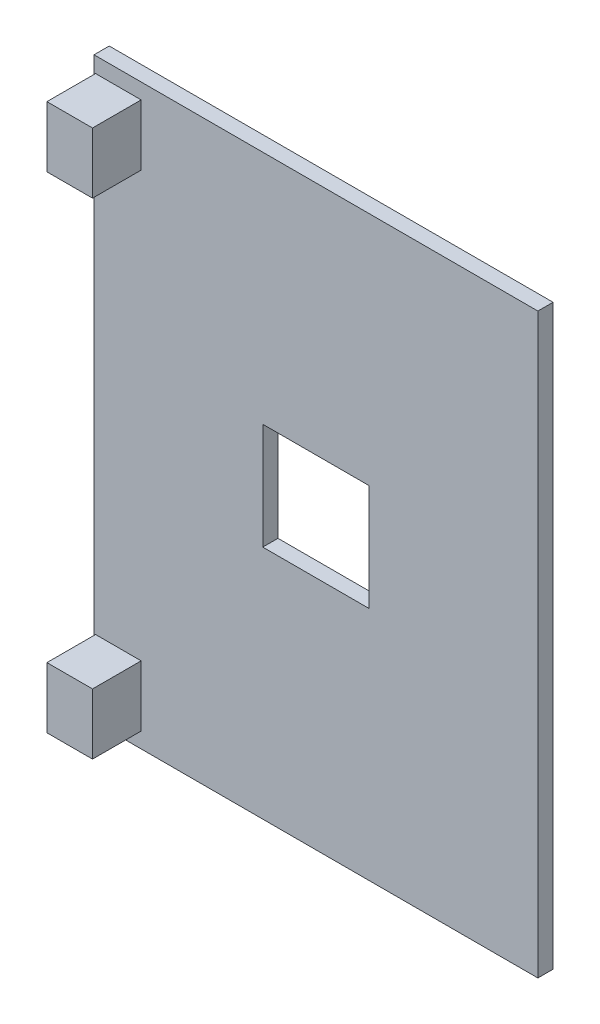
from build123d import *

# Parameters (mm, degrees)
ESQUISSE1_W             = 146
ESQUISSE1_H             = 190
BOSS_EXTRU_1_DEPTH      = 5
ESQUISSE15_W            = 15
ESQUISSE15_H            = 20
BOSS_EXTRU_7_DEPTH      = 16
ESQUISSE16_W            = 15
ESQUISSE16_H            = 20
BOSS_EXTRU_8_DEPTH      = 16
ESQUISSE17_W            = 35
ESQUISSE17_H            = 35
ENL_V_MAT_EXTRU_1_DEPTH = 5


with BuildPart() as part:
    # Esquisse1 → Boss.-Extru.1 (new body)
    with BuildSketch(Plane.XY):
        with Locations((-35.228613981, 18.194490743)):
            Rectangle(ESQUISSE1_W, ESQUISSE1_H)
    extrude(amount=BOSS_EXTRU_1_DEPTH)

    # Esquisse15 → Boss.-Extru.7 (add)
    with BuildSketch(Plane.XY.offset(5)):
        with Locations((-100.228613981, -61.705509257)):
            Rectangle(ESQUISSE15_W, ESQUISSE15_H)
    extrude(amount=BOSS_EXTRU_7_DEPTH)

    # Esquisse16 → Boss.-Extru.8 (add)
    with BuildSketch(Plane.XY.offset(5)):
        with Locations((-100.228613981, 98.094490743)):
            Rectangle(ESQUISSE16_W, ESQUISSE16_H)
    extrude(amount=BOSS_EXTRU_8_DEPTH)

    # Esquisse17 → Enlèv. mat.-Extru.1 (cut)
    with BuildSketch(Plane.XY.offset(5)):
        with Locations((-35.228613981, 18.194490743)):
            Rectangle(ESQUISSE17_W, ESQUISSE17_H)
    extrude(amount=-ENL_V_MAT_EXTRU_1_DEPTH, mode=Mode.SUBTRACT)


solid = part.part
